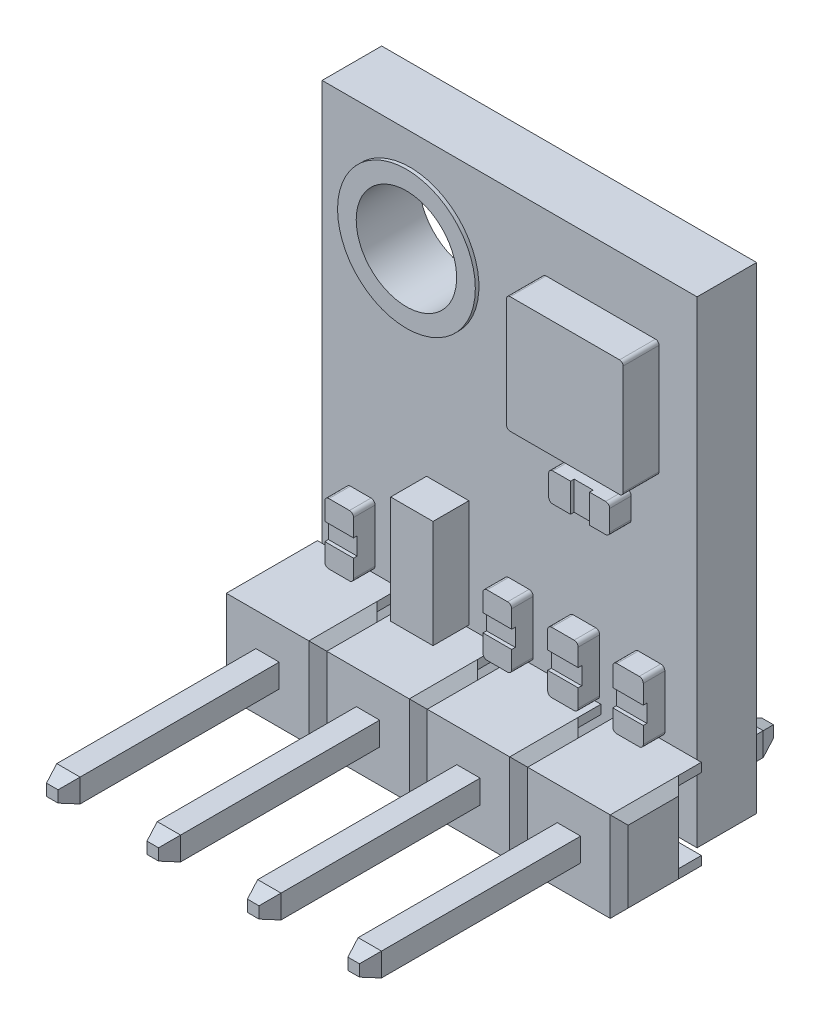
from build123d import *
from OCP.BRepFilletAPI import BRepFilletAPI_MakeChamfer

# Parameters (mm, degrees)
CROQUIS1_W                 = 10.45
CROQUIS1_H                 = 13.3
CROQUIS1_R                 = 1.4
SALIENTE_EXTRUIR1_DEPTH    = 1.66
SALIENTE_EXTRUIR2_DEPTH    = 1
SALIENTE_EXTRUIR3_DEPTH    = 0.6
CROQUIS4_R                 = 0.5
CORTAR_EXTRUIR1_DEPTH      = 2
CROQUIS5_W                 = 1.18
CROQUIS5_H                 = 3
SALIENTE_EXTRUIR4_DEPTH    = 1
SALIENTE_EXTRUIR5_START    = 0.1
CROQUIS6_R                 = 0.670494612
CROQUIS6_R_2               = 0.5
CROQUIS6_R_3               = 0.673168706
CROQUIS6_R_4               = 1.920139837
CROQUIS6_R_5               = 1.4
SALIENTE_EXTRUIR5_DEPTH    = 0.1
CROQUIS7_W                 = 0.8
CROQUIS7_H                 = 0.488253232
CROQUIS7_W_2               = 0.85
CROQUIS7_W_3               = 0.528941002
CROQUIS7_H_2               = 0.8
CORTAR_EXTRUIR2_DEPTH      = 0.1
BOSS_EXTRUDE1_DEPTH        = 2.54
CUT_EXTRUDE4_START         = -13.673989
CUT_EXTRUDE4_DEPTH         = 13.673989
SKETCH3_W                  = 0.635
SKETCH3_H                  = 2
CUT_EXTRUDE5_DEPTH         = 14.871424431
SKETCH5_W                  = 0.65
SKETCH5_H                  = 0.65
BOSS_EXTRUDE3_DEPTH        = 6
BOSS_EXTRUDE4_DEPTH        = 6
BOSS_EXTRUDE4_DEPTH_BACK   = 3
BOSS_EXTRUDE4_START        = -2.54
SKETCH5_2_W                = 0.65
SKETCH5_2_H                = 0.65
BOSS_EXTRUDE4_2_DEPTH      = 6
BOSS_EXTRUDE4_2_DEPTH_BACK = 3
BOSS_EXTRUDE4_2_START      = -2.54
BOSS_EXTRUDE4_3_DEPTH      = 6
BOSS_EXTRUDE4_3_DEPTH_BACK = 3
BOSS_EXTRUDE4_3_START      = -2.54
BOSS_EXTRUDE4_4_DEPTH      = 6
BOSS_EXTRUDE4_4_DEPTH_BACK = 3
BOSS_EXTRUDE4_4_START      = -2.54
CHAMFER1_SIZE              = 0.45
CHAMFER1_SIZE2             = 0.163786605
CHAMFER2_SIZE              = 0.45
CHAMFER2_SIZE2             = 0.163786605


with BuildPart() as part:
    # Croquis1 → Saliente-Extruir1 (new body)
    with BuildSketch(Plane.XY):
        Rectangle(CROQUIS1_W, CROQUIS1_H)
        with Locations(Location((-2.775, 3.86, 0), (0, 0, 180))):
            Circle(CROQUIS1_R, mode=Mode.SUBTRACT)
    extrude(amount=SALIENTE_EXTRUIR1_DEPTH)

    # Croquis2 → Saliente-Extruir2 (add)
    with BuildSketch(Plane.XY.offset(1.66)):
        with BuildLine():
            Line((1.014875741, 5.05), (4.064875741, 5.05))
            ThreePointArc((4.064875741, 5.05), (4.13558642, 5.020710678), (4.164875741, 4.95))
            Line((4.164875741, 4.95), (4.164875741, 1.9))
            ThreePointArc((4.164875741, 1.9), (4.13558642, 1.829289322), (4.064875741, 1.8))
            Line((4.064875741, 1.8), (1.014875741, 1.8))
            ThreePointArc((1.014875741, 1.8), (0.944165063, 1.829289322), (0.914875741, 1.9))
            Line((0.914875741, 1.9), (0.914875741, 4.95))
            ThreePointArc((0.914875741, 4.95), (0.944165063, 5.020710678), (1.014875741, 5.05))
        make_face()
    extrude(amount=SALIENTE_EXTRUIR2_DEPTH)

    # Croquis3 → Saliente-Extruir3 (add)
    with BuildSketch(Plane.XY.offset(1.66)):
        with BuildLine():
            Line((0.545086024, -4.450002724), (-0.029222615, -4.450002724))
            ThreePointArc((-0.029222615, -4.450002724), (-0.109016561, -4.41695099), (-0.142068295, -4.337157044))
            Line((-0.142068295, -4.337157044), (-0.142068295, -2.862848405))
            ThreePointArc((-0.142068295, -2.862848405), (-0.109016561, -2.783054459), (-0.029222615, -2.750002724))
            Line((-0.029222615, -2.750002724), (0.545086024, -2.750002724))
            ThreePointArc((0.545086024, -2.750002724), (0.62487997, -2.783054459), (0.657931705, -2.862848405))
            Line((0.657931705, -2.862848405), (0.657931705, -4.337157044))
            ThreePointArc((0.657931705, -4.337157044), (0.62487997, -4.41695099), (0.545086024, -4.450002724))
        make_face()
        with BuildLine():
            Line((-4.549824975, -4.337157044), (-4.549824975, -2.862848405))
            ThreePointArc((-4.549824975, -2.862848405), (-4.516773241, -2.783054459), (-4.436979295, -2.750002724))
            Line((-4.436979295, -2.750002724), (-3.862670656, -2.750002724))
            ThreePointArc((-3.862670656, -2.750002724), (-3.78287671, -2.783054459), (-3.749824975, -2.862848405))
            Line((-3.749824975, -2.862848405), (-3.749824975, -4.337157044))
            ThreePointArc((-3.749824975, -4.337157044), (-3.78287671, -4.41695099), (-3.862670656, -4.450002724))
            Line((-3.862670656, -4.450002724), (-4.436979295, -4.450002724))
            ThreePointArc((-4.436979295, -4.450002724), (-4.516773241, -4.41695099), (-4.549824975, -4.337157044))
        make_face()
        with BuildLine():
            Line((3.58895412, -2.716727386), (4.213262759, -2.716727386))
            ThreePointArc((4.213262759, -2.716727386), (4.293056705, -2.749779121), (4.32610844, -2.829573067))
            Line((4.32610844, -2.829573067), (4.32610844, -4.303881706))
            ThreePointArc((4.32610844, -4.303881706), (4.293056705, -4.383675652), (4.213262759, -4.416727386))
            Line((4.213262759, -4.416727386), (3.58895412, -4.416727386))
            ThreePointArc((3.58895412, -4.416727386), (3.509160174, -4.383675652), (3.47610844, -4.303881706))
            Line((3.47610844, -4.303881706), (3.47610844, -2.829573067))
            ThreePointArc((3.47610844, -2.829573067), (3.509160174, -2.749779121), (3.58895412, -2.716727386))
        make_face()
        with BuildLine():
            Line((1.661189231, -4.337157044), (1.661189231, -2.862848405))
            ThreePointArc((1.661189231, -2.862848405), (1.694240966, -2.783054459), (1.774034912, -2.750002724))
            Line((1.774034912, -2.750002724), (2.398343551, -2.750002724))
            ThreePointArc((2.398343551, -2.750002724), (2.478137497, -2.783054459), (2.511189231, -2.862848405))
            Line((2.511189231, -2.862848405), (2.511189231, -4.337157044))
            ThreePointArc((2.511189231, -4.337157044), (2.478137497, -4.41695099), (2.398343551, -4.450002724))
            Line((2.398343551, -4.450002724), (1.774034912, -4.450002724))
            ThreePointArc((1.774034912, -4.450002724), (1.694240966, -4.41695099), (1.661189231, -4.337157044))
        make_face()
        with BuildLine():
            Line((1.689875741, 0.350979107), (1.689875741, 0.925287746))
            ThreePointArc((1.689875741, 0.925287746), (1.722927476, 1.005081692), (1.802721422, 1.038133426))
            Line((1.802721422, 1.038133426), (3.277030061, 1.038133426))
            ThreePointArc((3.277030061, 1.038133426), (3.356824007, 1.005081692), (3.389875741, 0.925287746))
            Line((3.389875741, 0.925287746), (3.389875741, 0.350979107))
            ThreePointArc((3.389875741, 0.350979107), (3.356824007, 0.271185161), (3.277030061, 0.238133426))
            Line((3.277030061, 0.238133426), (1.802721422, 0.238133426))
            ThreePointArc((1.802721422, 0.238133426), (1.722927476, 0.271185161), (1.689875741, 0.350979107))
        make_face()
    extrude(amount=SALIENTE_EXTRUIR3_DEPTH)

    # Croquis4 → Cortar-Extruir1 (cut)
    with BuildSketch(Plane.XY.offset(1.66)):
        with Locations((4.194245203, -5.773988592)):
            Circle(CROQUIS4_R)
        with Locations((1.394245203, -5.773988592)):
            Circle(CROQUIS4_R)
        with Locations((-1.405754797, -5.773988592)):
            Circle(CROQUIS4_R)
        with Locations((-4.205754797, -5.773988592)):
            Circle(CROQUIS4_R)
    extrude(amount=-CORTAR_EXTRUIR1_DEPTH, mode=Mode.SUBTRACT)

    # Croquis5 → Saliente-Extruir4 (add)
    with BuildSketch(Plane.XY.offset(1.66)):
        with Locations((-1.72406111, -2.950002724)):
            Rectangle(CROQUIS5_W, CROQUIS5_H)
    extrude(amount=SALIENTE_EXTRUIR4_DEPTH)

    # Croquis6 → Saliente-Extruir5 (add)
    # profile 1 of 5: a face of its own
    with BuildSketch(Plane.XY.offset(1.66).offset(SALIENTE_EXTRUIR5_START)):
        with Locations(Location((-4.205754797, -5.773988592, 0), (0, 0, 180))):
            Circle(CROQUIS6_R)
        with Locations((-4.205754797, -5.773988592)):
            Circle(CROQUIS6_R_2, mode=Mode.SUBTRACT)
    # profile 2 of 5: a face of its own
    with BuildSketch(Plane.XY.offset(1.66).offset(SALIENTE_EXTRUIR5_START)):
        with Locations(Location((-1.405754797, -5.773988592, 0), (0, 0, 180))):
            Circle(CROQUIS6_R)
        with Locations((-1.405754797, -5.773988592)):
            Circle(CROQUIS6_R_2, mode=Mode.SUBTRACT)
    # profile 3 of 5: a face of its own
    with BuildSketch(Plane.XY.offset(1.66).offset(SALIENTE_EXTRUIR5_START)):
        with Locations(Location((1.394245203, -5.773988592, 0), (0, 0, 180))):
            Circle(CROQUIS6_R)
        with Locations((1.394245203, -5.773988592)):
            Circle(CROQUIS6_R_2, mode=Mode.SUBTRACT)
    # profile 4 of 5: a face of its own
    with BuildSketch(Plane.XY.offset(1.66).offset(SALIENTE_EXTRUIR5_START)):
        with Locations(Location((4.194245203, -5.773988592, 0), (0, 0, 180))):
            Circle(CROQUIS6_R_3)
        with Locations((4.194245203, -5.773988592)):
            Circle(CROQUIS6_R_2, mode=Mode.SUBTRACT)
    # profile 5 of 5: a face of its own
    with BuildSketch(Plane.XY.offset(1.66).offset(SALIENTE_EXTRUIR5_START)):
        with Locations(Location((-2.775, 3.86, 0), (0, 0, 180))):
            Circle(CROQUIS6_R_4)
        with Locations(Location((-2.775, 3.86, 0), (0, 0, 180))):
            Circle(CROQUIS6_R_5, mode=Mode.SUBTRACT)
    extrude(amount=-SALIENTE_EXTRUIR5_DEPTH)

    # Croquis7 → Cortar-Extruir2 (cut)
    with BuildSketch(Plane.XY.offset(2.26)):
        with Locations((-4.149824975, -3.600867586)):
            Rectangle(CROQUIS7_W, CROQUIS7_H)
        with Locations((0.257931705, -3.600867586)):
            Rectangle(CROQUIS7_W, CROQUIS7_H)
        with Locations((2.086189231, -3.600867586)):
            Rectangle(CROQUIS7_W_2, CROQUIS7_H)
        with Locations((3.90110844, -3.600867586)):
            Rectangle(CROQUIS7_W_2, CROQUIS7_H)
        with Locations((2.563329468, 0.638133426)):
            Rectangle(CROQUIS7_W_3, CROQUIS7_H_2)
    extrude(amount=-CORTAR_EXTRUIR2_DEPTH, mode=Mode.SUBTRACT)


with BuildPart() as body_2:
    # Sketch2 → Boss-Extrude1 (new body)
    with BuildSketch(Plane.XY.offset(1.66)):
        Polygon((-5.605754797, -4.773988592), (-5.355754797, -4.523988592), (-3.055754797, -4.523988592), (-2.805754797, -4.773988592), (-2.555754797, -4.523988592), (-0.255754797, -4.523988592), (-0.005754797, -4.773988592), (0.244245203, -4.523988592), (2.544245203, -4.523988592), (2.794245203, -4.773988592), (3.044245203, -4.523988592), (5.344245203, -4.523988592), (5.594245203, -4.773988592), (5.594245203, -6.773988592), (5.344245203, -7.023988592), (3.044245203, -7.023988592), (2.794245203, -6.773988592), (2.544245203, -7.023988592), (0.244245203, -7.023988592), (-0.005754797, -6.773988592), (-0.255754797, -7.023988592), (-2.555754797, -7.023988592), (-2.805754797, -6.773988592), (-3.055754797, -7.023988592), (-5.355754797, -7.023988592), (-5.605754797, -6.773988592), align=None)
    extrude(amount=BOSS_EXTRUDE1_DEPTH)

    # Sketch4 → Cut-Extrude4 (cut)
    with BuildSketch(Plane.XZ.offset(7.023988592).offset(CUT_EXTRUDE4_START)):
        Polygon((-5.355754797, 4.2), (-5.605754797, 3.95), (-5.605754797, 4.2), align=None)
        Polygon((-3.055754797, 4.2), (-2.805754797, 3.95), (-2.555754797, 4.2), align=None)
        Polygon((-0.255754797, 4.2), (-0.005754797, 3.95), (0.244245203, 4.2), align=None)
        Polygon((2.544245203, 4.2), (2.794245203, 3.95), (3.044245203, 4.2), align=None)
        Polygon((5.344245203, 4.2), (5.594245203, 3.95), (5.594245203, 4.2), align=None)
        Polygon((-5.605754797, 2.545), (-5.355754797, 2.295), (-5.355754797, 1.66), (-5.605754797, 1.66), align=None)
        Polygon((-3.055754797, 2.295), (-2.805754797, 2.545), (-2.555754797, 2.295), (-2.555754797, 1.66), (-3.055754797, 1.66), align=None)
        Polygon((-0.255754797, 2.295), (-0.005754797, 2.545), (0.244245203, 2.295), (0.244245203, 1.66), (-0.255754797, 1.66), align=None)
        Polygon((2.544245203, 2.295), (2.794245203, 2.545), (3.044245203, 2.295), (3.044245203, 1.66), (2.544245203, 1.66), align=None)
        Polygon((5.594245203, 1.66), (5.594245203, 2.545), (5.344245203, 2.295), (5.344245203, 1.66), align=None)
    extrude(amount=CUT_EXTRUDE4_DEPTH, mode=Mode.SUBTRACT)


with BuildPart() as cut_extrude5_tool:
    # Sketch3 → Cut-Extrude5 (new, through all)
    with BuildSketch(Plane(origin=(5.594245203, 0, 0), x_dir=(0, 0, -1), z_dir=(1, 0, 0))):
        with Locations((-1.9775, -5.773988592)):
            Rectangle(SKETCH3_W, SKETCH3_H)
    extrude(amount=-CUT_EXTRUDE5_DEPTH)


with BuildPart() as part_1:
    add(part.part)

    # Cut-Extrude5: cut by cut_extrude5_tool
    add(cut_extrude5_tool.part, mode=Mode.SUBTRACT)


with BuildPart() as body_2_1:
    add(body_2.part)

    # Cut-Extrude5: cut by cut_extrude5_tool
    add(cut_extrude5_tool.part, mode=Mode.SUBTRACT)

    # Sketch5 → Boss-Extrude3 (add)
    with BuildSketch(Plane.XY.offset(4.2)):
        with Locations((-4.205754797, -5.773988592)):
            Rectangle(SKETCH5_W, SKETCH5_H)
        with Locations((-1.405754797, -5.773988592)):
            Rectangle(SKETCH5_W, SKETCH5_H)
        with Locations((1.394245203, -5.773988592)):
            Rectangle(SKETCH5_W, SKETCH5_H)
        with Locations((4.194245203, -5.773988592)):
            Rectangle(SKETCH5_W, SKETCH5_H)
    extrude(amount=BOSS_EXTRUDE3_DEPTH)


with BuildPart() as body_3:
    # Sketch5<2> → Boss-Extrude4 (new, two sides: drawn at the far end of the back side and taken through both)
    with BuildSketch(Plane.XY.offset(4.2).offset(BOSS_EXTRUDE4_START - BOSS_EXTRUDE4_DEPTH_BACK)):
        with Locations((-4.205754797, -5.773988592)):
            Rectangle(SKETCH5_2_W, SKETCH5_2_H)
    extrude(amount=BOSS_EXTRUDE4_DEPTH + BOSS_EXTRUDE4_DEPTH_BACK)


with BuildPart() as body_4:
    # Sketch5<2> → Boss-Extrude4 2 (new, two sides: drawn at the far end of the back side and taken through both)
    with BuildSketch(Plane.XY.offset(4.2).offset(BOSS_EXTRUDE4_2_START - BOSS_EXTRUDE4_2_DEPTH_BACK)):
        with Locations((-1.405754797, -5.773988592)):
            Rectangle(SKETCH5_2_W, SKETCH5_2_H)
    extrude(amount=BOSS_EXTRUDE4_2_DEPTH + BOSS_EXTRUDE4_2_DEPTH_BACK)


with BuildPart() as body_5:
    # Sketch5<2> → Boss-Extrude4 3 (new, two sides: drawn at the far end of the back side and taken through both)
    with BuildSketch(Plane.XY.offset(4.2).offset(BOSS_EXTRUDE4_3_START - BOSS_EXTRUDE4_3_DEPTH_BACK)):
        with Locations((1.394245203, -5.773988592)):
            Rectangle(SKETCH5_2_W, SKETCH5_2_H)
    extrude(amount=BOSS_EXTRUDE4_3_DEPTH + BOSS_EXTRUDE4_3_DEPTH_BACK)


with BuildPart() as body_6:
    # Sketch5<2> → Boss-Extrude4 4 (new, two sides: drawn at the far end of the back side and taken through both)
    with BuildSketch(Plane.XY.offset(4.2).offset(BOSS_EXTRUDE4_4_START - BOSS_EXTRUDE4_4_DEPTH_BACK)):
        with Locations((4.194245203, -5.773988592)):
            Rectangle(SKETCH5_2_W, SKETCH5_2_H)
    extrude(amount=BOSS_EXTRUDE4_4_DEPTH + BOSS_EXTRUDE4_4_DEPTH_BACK)

    # Combine1: union body 5, body 4, body 3, body 2
    add(body_5.part)
    add(body_4.part)
    add(body_3.part)
    add(body_2_1.part)

    # Chamfer1: one chamfer whose edges measure the first distance from different faces: ONE call of the kernel's chamfer builder (chamfer() names one face for all edges)
    chamfer1_edges_1 = [body_6.edges().sort_by_distance(p)[0] for p in [
        (-4.530754797, -5.773988592, 10.2),
    ]]
    chamfer1_side_1 = [body_6.faces().sort_by_distance(p)[0] for p in [
        (-4.530754797, -5.773988592, 7.2),
    ]]
    chamfer1_edges_2 = [body_6.edges().sort_by_distance(p)[0] for p in [
        (-4.205754797, -6.098988592, 10.2),
    ]]
    chamfer1_side_2 = [body_6.faces().sort_by_distance(p)[0] for p in [
        (-4.205754797, -6.098988592, 7.2),
    ]]
    chamfer1_edges_3 = [body_6.edges().sort_by_distance(p)[0] for p in [
        (-3.880754797, -5.773988592, 10.2),
    ]]
    chamfer1_side_3 = [body_6.faces().sort_by_distance(p)[0] for p in [
        (-3.880754797, -5.773988592, 7.2),
    ]]
    chamfer1_edges_4 = [body_6.edges().sort_by_distance(p)[0] for p in [
        (-4.205754797, -5.448988592, 10.2),
    ]]
    chamfer1_side_4 = [body_6.faces().sort_by_distance(p)[0] for p in [
        (-4.205754797, -5.448988592, 7.2),
    ]]
    chamfer1_edges_5 = [body_6.edges().sort_by_distance(p)[0] for p in [
        (-1.730754797, -5.773988592, 10.2),
    ]]
    chamfer1_side_5 = [body_6.faces().sort_by_distance(p)[0] for p in [
        (-1.730754797, -5.773988592, 7.2),
    ]]
    chamfer1_edges_6 = [body_6.edges().sort_by_distance(p)[0] for p in [
        (-1.405754797, -6.098988592, 10.2),
    ]]
    chamfer1_side_6 = [body_6.faces().sort_by_distance(p)[0] for p in [
        (-1.405754797, -6.098988592, 7.2),
    ]]
    chamfer1_edges_7 = [body_6.edges().sort_by_distance(p)[0] for p in [
        (-1.080754797, -5.773988592, 10.2),
    ]]
    chamfer1_side_7 = [body_6.faces().sort_by_distance(p)[0] for p in [
        (-1.080754797, -5.773988592, 7.2),
    ]]
    chamfer1_edges_8 = [body_6.edges().sort_by_distance(p)[0] for p in [
        (-1.405754797, -5.448988592, 10.2),
    ]]
    chamfer1_side_8 = [body_6.faces().sort_by_distance(p)[0] for p in [
        (-1.405754797, -5.448988592, 7.2),
    ]]
    chamfer1_edges_9 = [body_6.edges().sort_by_distance(p)[0] for p in [
        (1.069245203, -5.773988592, 10.2),
    ]]
    chamfer1_side_9 = [body_6.faces().sort_by_distance(p)[0] for p in [
        (1.069245203, -5.773988592, 7.2),
    ]]
    chamfer1_edges_10 = [body_6.edges().sort_by_distance(p)[0] for p in [
        (1.394245203, -6.098988592, 10.2),
    ]]
    chamfer1_side_10 = [body_6.faces().sort_by_distance(p)[0] for p in [
        (1.394245203, -6.098988592, 7.2),
    ]]
    chamfer1_edges_11 = [body_6.edges().sort_by_distance(p)[0] for p in [
        (1.719245203, -5.773988592, 10.2),
    ]]
    chamfer1_side_11 = [body_6.faces().sort_by_distance(p)[0] for p in [
        (1.719245203, -5.773988592, 7.2),
    ]]
    chamfer1_edges_12 = [body_6.edges().sort_by_distance(p)[0] for p in [
        (1.394245203, -5.448988592, 10.2),
    ]]
    chamfer1_side_12 = [body_6.faces().sort_by_distance(p)[0] for p in [
        (1.394245203, -5.448988592, 7.2),
    ]]
    chamfer1_edges_13 = [body_6.edges().sort_by_distance(p)[0] for p in [
        (3.869245203, -5.773988592, 10.2),
    ]]
    chamfer1_side_13 = [body_6.faces().sort_by_distance(p)[0] for p in [
        (3.869245203, -5.773988592, 7.2),
    ]]
    chamfer1_edges_14 = [body_6.edges().sort_by_distance(p)[0] for p in [
        (4.194245203, -6.098988592, 10.2),
    ]]
    chamfer1_side_14 = [body_6.faces().sort_by_distance(p)[0] for p in [
        (4.194245203, -6.098988592, 7.2),
    ]]
    chamfer1_edges_15 = [body_6.edges().sort_by_distance(p)[0] for p in [
        (4.519245203, -5.773988592, 10.2),
    ]]
    chamfer1_side_15 = [body_6.faces().sort_by_distance(p)[0] for p in [
        (4.519245203, -5.773988592, 7.2),
    ]]
    chamfer1_edges_16 = [body_6.edges().sort_by_distance(p)[0] for p in [
        (4.194245203, -5.448988592, 10.2),
    ]]
    chamfer1_side_16 = [body_6.faces().sort_by_distance(p)[0] for p in [
        (4.194245203, -5.448988592, 7.2),
    ]]
    chamfer1 = BRepFilletAPI_MakeChamfer(body_6.part.solid().wrapped)
    for e in chamfer1_edges_1:
        chamfer1.Add(CHAMFER1_SIZE, CHAMFER1_SIZE2, e.wrapped, chamfer1_side_1[0].wrapped)  # the first distance lies on this face
    for e in chamfer1_edges_2:
        chamfer1.Add(CHAMFER1_SIZE, CHAMFER1_SIZE2, e.wrapped, chamfer1_side_2[0].wrapped)  # the first distance lies on this face
    for e in chamfer1_edges_3:
        chamfer1.Add(CHAMFER1_SIZE, CHAMFER1_SIZE2, e.wrapped, chamfer1_side_3[0].wrapped)  # the first distance lies on this face
    for e in chamfer1_edges_4:
        chamfer1.Add(CHAMFER1_SIZE, CHAMFER1_SIZE2, e.wrapped, chamfer1_side_4[0].wrapped)  # the first distance lies on this face
    for e in chamfer1_edges_5:
        chamfer1.Add(CHAMFER1_SIZE, CHAMFER1_SIZE2, e.wrapped, chamfer1_side_5[0].wrapped)  # the first distance lies on this face
    for e in chamfer1_edges_6:
        chamfer1.Add(CHAMFER1_SIZE, CHAMFER1_SIZE2, e.wrapped, chamfer1_side_6[0].wrapped)  # the first distance lies on this face
    for e in chamfer1_edges_7:
        chamfer1.Add(CHAMFER1_SIZE, CHAMFER1_SIZE2, e.wrapped, chamfer1_side_7[0].wrapped)  # the first distance lies on this face
    for e in chamfer1_edges_8:
        chamfer1.Add(CHAMFER1_SIZE, CHAMFER1_SIZE2, e.wrapped, chamfer1_side_8[0].wrapped)  # the first distance lies on this face
    for e in chamfer1_edges_9:
        chamfer1.Add(CHAMFER1_SIZE, CHAMFER1_SIZE2, e.wrapped, chamfer1_side_9[0].wrapped)  # the first distance lies on this face
    for e in chamfer1_edges_10:
        chamfer1.Add(CHAMFER1_SIZE, CHAMFER1_SIZE2, e.wrapped, chamfer1_side_10[0].wrapped)  # the first distance lies on this face
    for e in chamfer1_edges_11:
        chamfer1.Add(CHAMFER1_SIZE, CHAMFER1_SIZE2, e.wrapped, chamfer1_side_11[0].wrapped)  # the first distance lies on this face
    for e in chamfer1_edges_12:
        chamfer1.Add(CHAMFER1_SIZE, CHAMFER1_SIZE2, e.wrapped, chamfer1_side_12[0].wrapped)  # the first distance lies on this face
    for e in chamfer1_edges_13:
        chamfer1.Add(CHAMFER1_SIZE, CHAMFER1_SIZE2, e.wrapped, chamfer1_side_13[0].wrapped)  # the first distance lies on this face
    for e in chamfer1_edges_14:
        chamfer1.Add(CHAMFER1_SIZE, CHAMFER1_SIZE2, e.wrapped, chamfer1_side_14[0].wrapped)  # the first distance lies on this face
    for e in chamfer1_edges_15:
        chamfer1.Add(CHAMFER1_SIZE, CHAMFER1_SIZE2, e.wrapped, chamfer1_side_15[0].wrapped)  # the first distance lies on this face
    for e in chamfer1_edges_16:
        chamfer1.Add(CHAMFER1_SIZE, CHAMFER1_SIZE2, e.wrapped, chamfer1_side_16[0].wrapped)  # the first distance lies on this face
    add(Compound.cast(chamfer1.Shape()), mode=Mode.REPLACE)

    # Chamfer2: one chamfer whose edges measure the first distance from different faces: ONE call of the kernel's chamfer builder (chamfer() names one face for all edges)
    chamfer2_edges_1 = [body_6.edges().sort_by_distance(p)[0] for p in [
        (1.069245203, -5.773988592, -1.34),
    ]]
    chamfer2_side_1 = [body_6.faces().sort_by_distance(p)[0] for p in [
        (1.069245203, -5.773988592, 0.4775),
    ]]
    chamfer2_edges_2 = [body_6.edges().sort_by_distance(p)[0] for p in [
        (1.394245203, -6.098988592, -1.34),
    ]]
    chamfer2_side_2 = [body_6.faces().sort_by_distance(p)[0] for p in [
        (1.394245203, -6.098988592, 0.4775),
    ]]
    chamfer2_edges_3 = [body_6.edges().sort_by_distance(p)[0] for p in [
        (1.719245203, -5.773988592, -1.34),
    ]]
    chamfer2_side_3 = [body_6.faces().sort_by_distance(p)[0] for p in [
        (1.719245203, -5.773988592, 0.4775),
    ]]
    chamfer2_edges_4 = [body_6.edges().sort_by_distance(p)[0] for p in [
        (1.394245203, -5.448988592, -1.34),
    ]]
    chamfer2_side_4 = [body_6.faces().sort_by_distance(p)[0] for p in [
        (1.394245203, -5.448988592, 0.4775),
    ]]
    chamfer2_edges_5 = [body_6.edges().sort_by_distance(p)[0] for p in [
        (-1.730754797, -5.773988592, -1.34),
    ]]
    chamfer2_side_5 = [body_6.faces().sort_by_distance(p)[0] for p in [
        (-1.730754797, -5.773988592, 0.4775),
    ]]
    chamfer2_edges_6 = [body_6.edges().sort_by_distance(p)[0] for p in [
        (-1.405754797, -6.098988592, -1.34),
    ]]
    chamfer2_side_6 = [body_6.faces().sort_by_distance(p)[0] for p in [
        (-1.405754797, -6.098988592, 0.4775),
    ]]
    chamfer2_edges_7 = [body_6.edges().sort_by_distance(p)[0] for p in [
        (-1.080754797, -5.773988592, -1.34),
    ]]
    chamfer2_side_7 = [body_6.faces().sort_by_distance(p)[0] for p in [
        (-1.080754797, -5.773988592, 0.4775),
    ]]
    chamfer2_edges_8 = [body_6.edges().sort_by_distance(p)[0] for p in [
        (-1.405754797, -5.448988592, -1.34),
    ]]
    chamfer2_side_8 = [body_6.faces().sort_by_distance(p)[0] for p in [
        (-1.405754797, -5.448988592, 0.4775),
    ]]
    chamfer2_edges_9 = [body_6.edges().sort_by_distance(p)[0] for p in [
        (-4.530754797, -5.773988592, -1.34),
    ]]
    chamfer2_side_9 = [body_6.faces().sort_by_distance(p)[0] for p in [
        (-4.530754797, -5.773988592, 0.4775),
    ]]
    chamfer2_edges_10 = [body_6.edges().sort_by_distance(p)[0] for p in [
        (-4.205754797, -6.098988592, -1.34),
    ]]
    chamfer2_side_10 = [body_6.faces().sort_by_distance(p)[0] for p in [
        (-4.205754797, -6.098988592, 0.4775),
    ]]
    chamfer2_edges_11 = [body_6.edges().sort_by_distance(p)[0] for p in [
        (-3.880754797, -5.773988592, -1.34),
    ]]
    chamfer2_side_11 = [body_6.faces().sort_by_distance(p)[0] for p in [
        (-3.880754797, -5.773988592, 0.4775),
    ]]
    chamfer2_edges_12 = [body_6.edges().sort_by_distance(p)[0] for p in [
        (-4.205754797, -5.448988592, -1.34),
    ]]
    chamfer2_side_12 = [body_6.faces().sort_by_distance(p)[0] for p in [
        (-4.205754797, -5.448988592, 0.4775),
    ]]
    chamfer2_edges_13 = [body_6.edges().sort_by_distance(p)[0] for p in [
        (3.869245203, -5.773988592, -1.34),
    ]]
    chamfer2_side_13 = [body_6.faces().sort_by_distance(p)[0] for p in [
        (3.869245203, -5.773988592, 0.4775),
    ]]
    chamfer2_edges_14 = [body_6.edges().sort_by_distance(p)[0] for p in [
        (4.194245203, -5.448988592, -1.34),
    ]]
    chamfer2_side_14 = [body_6.faces().sort_by_distance(p)[0] for p in [
        (4.194245203, -5.448988592, 0.4775),
    ]]
    chamfer2_edges_15 = [body_6.edges().sort_by_distance(p)[0] for p in [
        (4.519245203, -5.773988592, -1.34),
    ]]
    chamfer2_side_15 = [body_6.faces().sort_by_distance(p)[0] for p in [
        (4.519245203, -5.773988592, 0.4775),
    ]]
    chamfer2_edges_16 = [body_6.edges().sort_by_distance(p)[0] for p in [
        (4.194245203, -6.098988592, -1.34),
    ]]
    chamfer2_side_16 = [body_6.faces().sort_by_distance(p)[0] for p in [
        (4.194245203, -6.098988592, 0.4775),
    ]]
    chamfer2 = BRepFilletAPI_MakeChamfer(body_6.part.solid().wrapped)
    for e in chamfer2_edges_1:
        chamfer2.Add(CHAMFER2_SIZE, CHAMFER2_SIZE2, e.wrapped, chamfer2_side_1[0].wrapped)  # the first distance lies on this face
    for e in chamfer2_edges_2:
        chamfer2.Add(CHAMFER2_SIZE, CHAMFER2_SIZE2, e.wrapped, chamfer2_side_2[0].wrapped)  # the first distance lies on this face
    for e in chamfer2_edges_3:
        chamfer2.Add(CHAMFER2_SIZE, CHAMFER2_SIZE2, e.wrapped, chamfer2_side_3[0].wrapped)  # the first distance lies on this face
    for e in chamfer2_edges_4:
        chamfer2.Add(CHAMFER2_SIZE, CHAMFER2_SIZE2, e.wrapped, chamfer2_side_4[0].wrapped)  # the first distance lies on this face
    for e in chamfer2_edges_5:
        chamfer2.Add(CHAMFER2_SIZE, CHAMFER2_SIZE2, e.wrapped, chamfer2_side_5[0].wrapped)  # the first distance lies on this face
    for e in chamfer2_edges_6:
        chamfer2.Add(CHAMFER2_SIZE, CHAMFER2_SIZE2, e.wrapped, chamfer2_side_6[0].wrapped)  # the first distance lies on this face
    for e in chamfer2_edges_7:
        chamfer2.Add(CHAMFER2_SIZE, CHAMFER2_SIZE2, e.wrapped, chamfer2_side_7[0].wrapped)  # the first distance lies on this face
    for e in chamfer2_edges_8:
        chamfer2.Add(CHAMFER2_SIZE, CHAMFER2_SIZE2, e.wrapped, chamfer2_side_8[0].wrapped)  # the first distance lies on this face
    for e in chamfer2_edges_9:
        chamfer2.Add(CHAMFER2_SIZE, CHAMFER2_SIZE2, e.wrapped, chamfer2_side_9[0].wrapped)  # the first distance lies on this face
    for e in chamfer2_edges_10:
        chamfer2.Add(CHAMFER2_SIZE, CHAMFER2_SIZE2, e.wrapped, chamfer2_side_10[0].wrapped)  # the first distance lies on this face
    for e in chamfer2_edges_11:
        chamfer2.Add(CHAMFER2_SIZE, CHAMFER2_SIZE2, e.wrapped, chamfer2_side_11[0].wrapped)  # the first distance lies on this face
    for e in chamfer2_edges_12:
        chamfer2.Add(CHAMFER2_SIZE, CHAMFER2_SIZE2, e.wrapped, chamfer2_side_12[0].wrapped)  # the first distance lies on this face
    for e in chamfer2_edges_13:
        chamfer2.Add(CHAMFER2_SIZE, CHAMFER2_SIZE2, e.wrapped, chamfer2_side_13[0].wrapped)  # the first distance lies on this face
    for e in chamfer2_edges_14:
        chamfer2.Add(CHAMFER2_SIZE, CHAMFER2_SIZE2, e.wrapped, chamfer2_side_14[0].wrapped)  # the first distance lies on this face
    for e in chamfer2_edges_15:
        chamfer2.Add(CHAMFER2_SIZE, CHAMFER2_SIZE2, e.wrapped, chamfer2_side_15[0].wrapped)  # the first distance lies on this face
    for e in chamfer2_edges_16:
        chamfer2.Add(CHAMFER2_SIZE, CHAMFER2_SIZE2, e.wrapped, chamfer2_side_16[0].wrapped)  # the first distance lies on this face
    add(Compound.cast(chamfer2.Shape()), mode=Mode.REPLACE)


solid = Compound([part_1.part, body_6.part])
